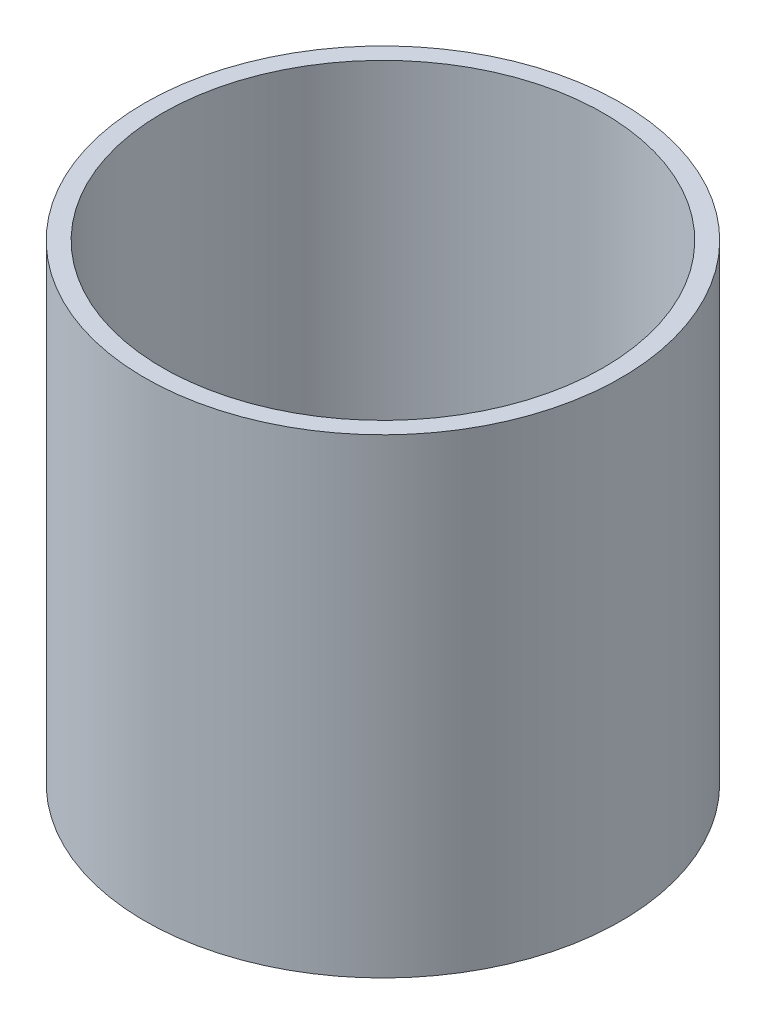
from build123d import *

# Parameters (mm, degrees)
SKETCH2_R                   = 2.3
CUT_EXTRUDE1_DEPTH          = 5.5
CUT_EXTRUDE1_DRAFT          = -4.35
CIRPATTERN1_COPY_1_SKETCH_R = 2.3
CIRPATTERN1_COPY_1_DEPTH    = 5.5
CIRPATTERN1_COPY_1_DRAFT    = -4.35
CIRPATTERN1_COPY_2_SKETCH_R = 2.3
CIRPATTERN1_COPY_2_DEPTH    = 5.5
CIRPATTERN1_COPY_2_DRAFT    = -4.35
CIRPATTERN1_COPY_3_SKETCH_R = 2.3
CIRPATTERN1_COPY_3_DEPTH    = 5.5
CIRPATTERN1_COPY_3_DRAFT    = -4.35


with BuildPart() as part:
    # Sketch1 → Revolve1 (revolve)
    with BuildSketch(Plane.XY):
        with BuildLine():
            Line((0, 0), (-40.5, 0))
            Line((-40.5, 0), (-40.5, 80))
            Line((-40.5, 80), (-37.5, 80))
            Line((-37.5, 80), (-37.5, 15.5))
            ThreePointArc((-37.5, 15.5), (-34.571067812, 8.428932188), (-27.5, 5.5))
            Line((-27.5, 5.5), (0, 5.5))
            Line((0, 5.5), (0, 0))
        make_face()
    revolve(axis=Axis((0, 5.5, 0), (0, -1, 0)))


with BuildPart() as cut_extrude1_tool:
    # Sketch2 → Cut-Extrude1 (with draft: the straight prism first)
    with BuildSketch(Plane.XZ):
        with Locations((0, 12.7)):
            Circle(SKETCH2_R)
    extrude(amount=-CUT_EXTRUDE1_DEPTH)
    # Cut-Extrude1: the draft: its side faces are tilted about the plane it starts from
    cut_extrude1_sides = [cut_extrude1_tool.faces().sort_by_distance(p)[0] for p in [
        (-2.3, 2.75, 12.7),
    ]]
    draft(cut_extrude1_sides, Plane.XZ, CUT_EXTRUDE1_DRAFT)


with BuildPart() as part_1:
    add(part.part)

    # Cut-Extrude1: cut by cut_extrude1_tool
    add(cut_extrude1_tool.part, mode=Mode.SUBTRACT)


with BuildPart() as cirpattern1_copy_1_tool:
    # CirPattern1 copy 1 sketch → CirPattern1 copy 1 (with draft: the straight prism first)
    with BuildSketch(Plane(origin=(0, 0, 0), x_dir=(0, 0, -1), z_dir=(0, -1, 0))):
        with Locations((0, 12.7)):
            Circle(CIRPATTERN1_COPY_1_SKETCH_R)
    extrude(amount=-CIRPATTERN1_COPY_1_DEPTH)
    # CirPattern1 copy 1: the draft: its side faces are tilted about the plane it starts from
    cirpattern1_copy_1_sides = [cirpattern1_copy_1_tool.faces().sort_by_distance(p)[0] for p in [
        (12.7, 2.75, 2.3),
    ]]
    draft(cirpattern1_copy_1_sides, Plane(origin=(0, 0, 0), x_dir=(0, 0, -1), z_dir=(0, -1, 0)), CIRPATTERN1_COPY_1_DRAFT)


with BuildPart() as part_2:
    add(part_1.part)

    # CirPattern1 copy 1: cut by cirpattern1_copy_1_tool
    add(cirpattern1_copy_1_tool.part, mode=Mode.SUBTRACT)


with BuildPart() as cirpattern1_copy_2_tool:
    # CirPattern1 copy 2 sketch → CirPattern1 copy 2 (with draft: the straight prism first)
    with BuildSketch(Plane(origin=(0, 0, 0), x_dir=(-1, 0, 0), z_dir=(0, -1, 0))):
        with Locations((0, 12.7)):
            Circle(CIRPATTERN1_COPY_2_SKETCH_R)
    extrude(amount=-CIRPATTERN1_COPY_2_DEPTH)
    # CirPattern1 copy 2: the draft: its side faces are tilted about the plane it starts from
    cirpattern1_copy_2_sides = [cirpattern1_copy_2_tool.faces().sort_by_distance(p)[0] for p in [
        (2.3, 2.75, -12.7),
    ]]
    draft(cirpattern1_copy_2_sides, Plane(origin=(0, 0, 0), x_dir=(-1, 0, 0), z_dir=(0, -1, 0)), CIRPATTERN1_COPY_2_DRAFT)


with BuildPart() as part_3:
    add(part_2.part)

    # CirPattern1 copy 2: cut by cirpattern1_copy_2_tool
    add(cirpattern1_copy_2_tool.part, mode=Mode.SUBTRACT)


with BuildPart() as cirpattern1_copy_3_tool:
    # CirPattern1 copy 3 sketch → CirPattern1 copy 3 (with draft: the straight prism first)
    with BuildSketch(Plane(origin=(0, 0, 0), x_dir=(0, 0, 1), z_dir=(0, -1, 0))):
        with Locations((0, 12.7)):
            Circle(CIRPATTERN1_COPY_3_SKETCH_R)
    extrude(amount=-CIRPATTERN1_COPY_3_DEPTH)
    # CirPattern1 copy 3: the draft: its side faces are tilted about the plane it starts from
    cirpattern1_copy_3_sides = [cirpattern1_copy_3_tool.faces().sort_by_distance(p)[0] for p in [
        (-12.7, 2.75, -2.3),
    ]]
    draft(cirpattern1_copy_3_sides, Plane(origin=(0, 0, 0), x_dir=(0, 0, 1), z_dir=(0, -1, 0)), CIRPATTERN1_COPY_3_DRAFT)


with BuildPart() as part_4:
    add(part_3.part)

    # CirPattern1 copy 3: cut by cirpattern1_copy_3_tool
    add(cirpattern1_copy_3_tool.part, mode=Mode.SUBTRACT)


solid = part_4.part
